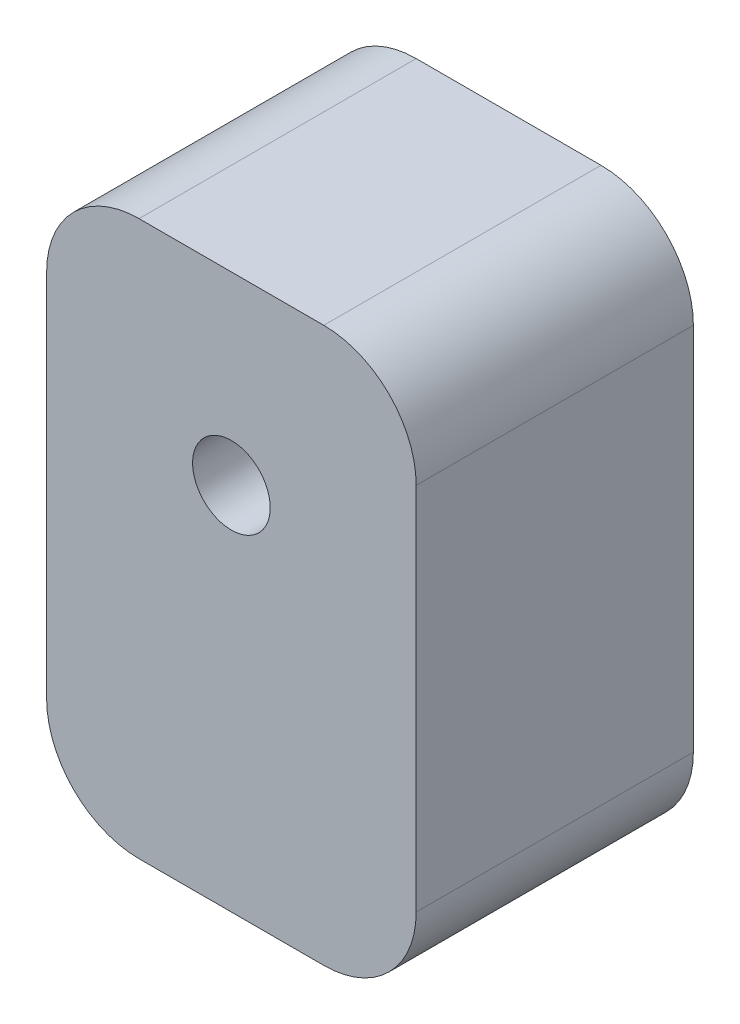
from build123d import *

# Parameters (mm, degrees)
SKETCH_2_W      = 20
SKETCH_2_H      = 30
SKETCH_2_R      = 2.1
EXTRUDE_1_DEPTH = 15
SKETCH_3_W      = 5.8
SKETCH_3_H      = 10
EXTRUDE_2_DEPTH = 3
FILLET_1_R      = 5


with BuildPart() as part:
    # ｽｹｯﾁ2 → ﾎﾞｽ - 押し出し1 (new body)
    with BuildSketch(Plane.XY):
        Rectangle(SKETCH_2_W, SKETCH_2_H)
        with Locations((0, 5)):
            Circle(SKETCH_2_R, mode=Mode.SUBTRACT)
    extrude(amount=EXTRUDE_1_DEPTH)

    # ｽｹｯﾁ3 → ﾎﾞｽ - 押し出し2 (add)
    with BuildSketch(Plane(origin=(0, 0, 0), x_dir=(-1, 0, 0), z_dir=(0, 0, -1))):
        with Locations((0, -10)):
            Rectangle(SKETCH_3_W, SKETCH_3_H)
    extrude(amount=EXTRUDE_2_DEPTH)

    # ﾌｨﾚｯﾄ1
    fillet_1_edges = [part.edges().sort_by_distance(p)[0] for p in [
        (10, -15, 7.5),
        (-10, -15, 7.5),
        (-10, 15, 7.5),
        (10, 15, 7.5),
    ]]
    fillet(fillet_1_edges, radius=FILLET_1_R)


solid = part.part
